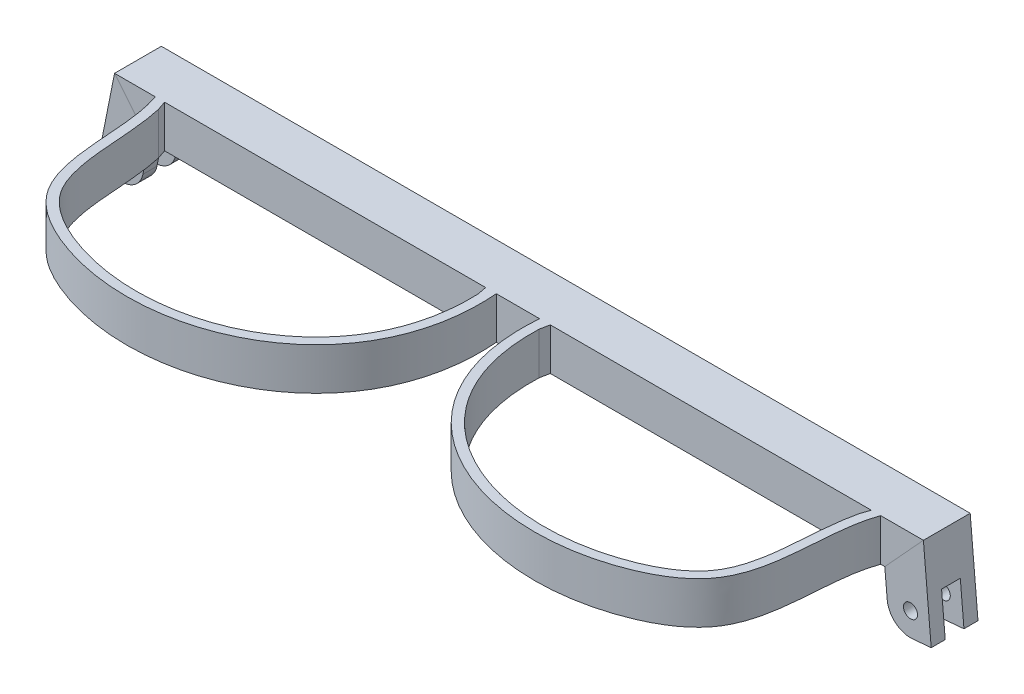
from build123d import *

# Parameters (mm, degrees)
FRAME_DEPTH              = 9
SKETCH_1035_W            = 10
SKETCH_1035_H            = 9
CONNECTION_2_DEPTH       = 103.044080854
SKETCH_23_W              = 10
SKETCH_23_H              = 9
SKETCH_24_R              = 1.5
AND_CONNECTION_DEPTH     = 104.419167617
SKETCH_25_W              = 6
SKETCH_25_H              = 7.2
CUT_EXTRUDE_2670_DEPTH   = 77.5
SKETCH_25_2_W            = 6
SKETCH_25_2_H            = 7.2
CUT_EXTRUDE_2723_DEPTH   = 77.5
SKETCH_1600_R            = 1.5
CUT_EXTRUDE_3036_DEPTH   = 104.349280079
CONNECTION_4_DEPTH       = 2
CONNECTION_4_DEPTH_BACK  = 2
CUT_EXTRUDE_3_DEPTH      = 2
CUT_EXTRUDE_3_DEPTH_BACK = 2


with BuildPart() as part:
    # 草图1 → frame (new body)
    with BuildSketch(Plane(origin=(0, 0, 0), x_dir=(1, 0, 0), z_dir=(0, 1, 0))):
        with BuildLine():
            Line((77.5, 21.66163142), (-77.5, 21.66163142))
            Line((-77.5, 21.66163142), (-77.5, 11.66163142))
            add(Edge.make_bspline(
                [(-77.5, 11.66163142), (-74.407700798, 3.186863233), (-78.13080327, -15.927288699), (-40.25886312, -37.426028597), (-2.116282918, -20.689046368), (-4.622356495, 11.66163142)],
                knots=[0, 0, 0, 0, 0.2461215, 0.369792099, 1, 1, 1, 1], degree=3))
            Line((-4.622356495, 11.66163142), (4.622356495, 11.66163142))
            add(Edge.make_bspline(
                [(77.5, 11.66163142), (74.407700798, 3.186863233), (78.13080327, -15.927288699), (40.25886312, -37.426028597), (2.116282918, -20.689046368), (4.622356495, 11.66163142)],
                knots=[0, 0, 0, 0, 0.2461215, 0.369792099, 1, 1, 1, 1], degree=3))
            Line((77.5, 11.66163142), (77.5, 21.66163142))
        make_face()
        with BuildLine():
            Line((6.907388487, 11.66163142), (75.498489426, 11.66163142))
            Line((75.498489426, 11.66163142), (74.826320569, 9.66163142))
            add(Edge.make_bspline(
                [(74.826320569, 9.66163142), (74.537129512, 8.440205397), (74.118616889, 5.97852646), (73.621822389, 0.86906895), (73.254603503, -5.556962308), (72.241025744, -11.370637322), (70.601393479, -15.207799235), (68.270143007, -18.43048657), (63.731478169, -21.762919869), (56.85425746, -24.533410045), (49.722568077, -26.119696622), (40.058249914, -26.656581209), (30.63607695, -24.877975202), (22.314225365, -20.908251341), (16.828859323, -16.874650673), (12.291217041, -11.816635216), (9.449850549, -6.759991518), (7.834253455, -2.202532167), (6.977086921, 1.473147324), (6.581231794, 4.759863142), (6.469661343, 7.510165764), (6.485645336, 8.950311376), (6.511310136, 9.66163142)],
                knots=[0.022831488, 0.022831488, 0.022831488, 0.022831488, 0.052972273, 0.083113058, 0.143394628, 0.203676198, 0.233816983, 0.263957769, 0.324239339, 0.384520909, 0.444802479, 0.505084049, 0.625647189, 0.685928759, 0.746210329, 0.806491899, 0.866773469, 0.896914254, 0.92705504, 0.957195825, 0.972266217, 0.98733661, 0.98733661, 0.98733661, 0.98733661], degree=3))
            Line((6.511310136, 9.66163142), (6.907388487, 11.66163142))
        make_face(mode=Mode.SUBTRACT)
        with BuildLine():
            Line((-75.498489426, 11.66163142), (-6.907388487, 11.66163142))
            Line((-6.907388487, 11.66163142), (-6.511310136, 9.66163142))
            add(Edge.make_bspline(
                [(-74.826320569, 9.66163142), (-74.537129512, 8.440205397), (-74.118616889, 5.97852646), (-73.621822389, 0.86906895), (-73.254603503, -5.556962308), (-72.241025744, -11.370637322), (-70.601393479, -15.207799235), (-68.270143007, -18.43048657), (-63.731478169, -21.762919869), (-56.85425746, -24.533410045), (-49.722568077, -26.119696622), (-40.058249914, -26.656581209), (-30.63607695, -24.877975202), (-22.314225365, -20.908251341), (-16.828859323, -16.874650673), (-12.291217041, -11.816635216), (-9.449850549, -6.759991518), (-7.834253455, -2.202532167), (-6.977086921, 1.473147324), (-6.581231794, 4.759863142), (-6.469661343, 7.510165764), (-6.485645336, 8.950311376), (-6.511310136, 9.66163142)],
                knots=[0.022831488, 0.022831488, 0.022831488, 0.022831488, 0.052972273, 0.083113058, 0.143394628, 0.203676198, 0.233816983, 0.263957769, 0.324239339, 0.384520909, 0.444802479, 0.505084049, 0.625647189, 0.685928759, 0.746210329, 0.806491899, 0.866773469, 0.896914254, 0.92705504, 0.957195825, 0.972266217, 0.98733661, 0.98733661, 0.98733661, 0.98733661], degree=3))
            Line((-74.826320569, 9.66163142), (-75.498489426, 11.66163142))
        make_face(mode=Mode.SUBTRACT)
    extrude(amount=FRAME_DEPTH)

    # connection: sweep along a path in Sketch 1207
    with BuildLine(Plane(origin=(0, 0, -16.66163142), x_dir=(-1, 0, 0), z_dir=(0, 0, -1))) as connection_path:
        Line((-77.5, 4.5), (-82.5, 4.5))
        Line((-82.5, 4.5), (-83.807336141, -10.442920471))
    # Sketch 1035 → connection (sweep)
    with BuildSketch(Plane(origin=(77.5, 0, 0), x_dir=(0, 0, -1), z_dir=(1, 0, 0))):
        with Locations((16.66163142, 4.5)):
            Rectangle(SKETCH_1035_W, SKETCH_1035_H)
    sweep(path=connection_path.line, transition=Transition.RIGHT)

    # 草图20 → connection 2 (cut, through all)
    with BuildSketch(Plane(origin=(0, 0, -21.66163142), x_dir=(-1, 0, 0), z_dir=(0, 0, -1))):
        with BuildLine():
            Line((-79.32446, -10.835121314), (-84.30543349, -10.3993426))
            ThreePointArc((-84.30543349, -10.3993426), (-80.655716728, -9.248591325), (-78.888681286, -5.854147823))
            Line((-78.888681286, -5.854147823), (-79.32446, -10.835121314))
        make_face()
    extrude(amount=-CONNECTION_2_DEPTH, mode=Mode.SUBTRACT)

    # connection 3: sweep along a path in 草图22
    with BuildLine(Plane(origin=(0, 0, -16.66163142), x_dir=(-1, 0, 0), z_dir=(0, 0, -1))) as connection_3_path:
        Line((77.5, 4.5), (82.5, 4.5))
        Line((82.5, 4.5), (85.431638554, -10.210727222))
    # 草图23 → connection 3 (sweep)
    with BuildSketch(Plane.ZY.offset(77.5)):
        with Locations((-16.66163142, 4.5)):
            Rectangle(SKETCH_23_W, SKETCH_23_H)
    sweep(path=connection_3_path.line, transition=Transition.RIGHT)

    # 草图24 → 右侧孔and_connection圆角化 (cut, through all)
    with BuildSketch(Plane(origin=(0, 0, -21.66163142), x_dir=(-1, 0, 0), z_dir=(0, 0, -1))):
        with Locations((84.972025364, -5.204001236)):
            Circle(SKETCH_24_R)
        with BuildLine():
            Line((81.018420388, -11.090218788), (85.431638554, -10.210727222))
            ThreePointArc((85.431638554, -10.210727222), (82.053424946, -9.540019998), (80.138928822, -6.677000621))
            Line((80.138928822, -6.677000621), (81.018420388, -11.090218788))
        make_face()
    extrude(amount=-AND_CONNECTION_DEPTH, mode=Mode.SUBTRACT)

    # 草图25 → Cut-Extrude 2670 (cut)
    with BuildSketch(Plane(origin=(0, 0, 0), x_dir=(0, 0, -1), z_dir=(1, 0, 0))):
        with Locations((16.66163142, 3.6)):
            Rectangle(SKETCH_25_W, SKETCH_25_H)
    extrude(amount=-CUT_EXTRUDE_2670_DEPTH, mode=Mode.SUBTRACT)

    # 草图25<2> → Cut-Extrude 2723 (cut)
    with BuildSketch(Plane(origin=(0, 0, 0), x_dir=(0, 0, -1), z_dir=(1, 0, 0))):
        with Locations((16.66163142, 3.6)):
            Rectangle(SKETCH_25_2_W, SKETCH_25_2_H)
    extrude(amount=CUT_EXTRUDE_2723_DEPTH, mode=Mode.SUBTRACT)

    # Sketch 1600 → Cut-Extrude 3036 (cut, through all)
    with BuildSketch(Plane(origin=(0, 0, -21.66163142), x_dir=(-1, 0, 0), z_dir=(0, 0, -1))):
        with Locations((-83.869654777, -5.41836911)):
            Circle(SKETCH_1600_R)
    extrude(amount=-CUT_EXTRUDE_3036_DEPTH, mode=Mode.SUBTRACT)

    # 草图27 → connection 4 (cut, two sides: drawn at the far end of the back side and taken through both)
    with BuildSketch(Plane(origin=(0, 0, -16.66163142), x_dir=(-1, 0, 0), z_dir=(0, 0, -1)).offset(-CONNECTION_4_DEPTH_BACK)):
        with BuildLine():
            Line((-87.505810598, -1.084967346), (-78.540058315, -1.869369031))
            Line((-78.540058315, -1.869369031), (-78.932259157, -6.352245172))
            ThreePointArc((-78.932259157, -6.352245172), (-80.522591055, -9.407244324), (-83.807336141, -10.442920471))
            Line((-83.807336141, -10.442920471), (-88.290212283, -10.050719629))
            Line((-88.290212283, -10.050719629), (-87.505810598, -1.084967346))
        make_face()
    extrude(amount=CONNECTION_4_DEPTH + CONNECTION_4_DEPTH_BACK, mode=Mode.SUBTRACT)

    # 草图30 → 切除-拉伸3 (cut, two sides: drawn at the far end of the back side and taken through both)
    with BuildSketch(Plane(origin=(0, 0, -16.66163142), x_dir=(-1, 0, 0), z_dir=(0, 0, -1)).offset(-CUT_EXTRUDE_3_DEPTH_BACK)):
        with BuildLine():
            Line((89.844856721, -9.331235655), (85.431638554, -10.210727222))
            ThreePointArc((85.431638554, -10.210727222), (82.053424946, -9.540019998), (80.138928822, -6.677000621))
            Line((80.138928822, -6.677000621), (79.259652435, -2.264862208))
            Line((79.259652435, -2.264862208), (88.086088768, -0.505879075))
            Line((88.086088768, -0.505879075), (89.844856721, -9.331235655))
        make_face()
    extrude(amount=CUT_EXTRUDE_3_DEPTH + CUT_EXTRUDE_3_DEPTH_BACK, mode=Mode.SUBTRACT)


solid = part.part
